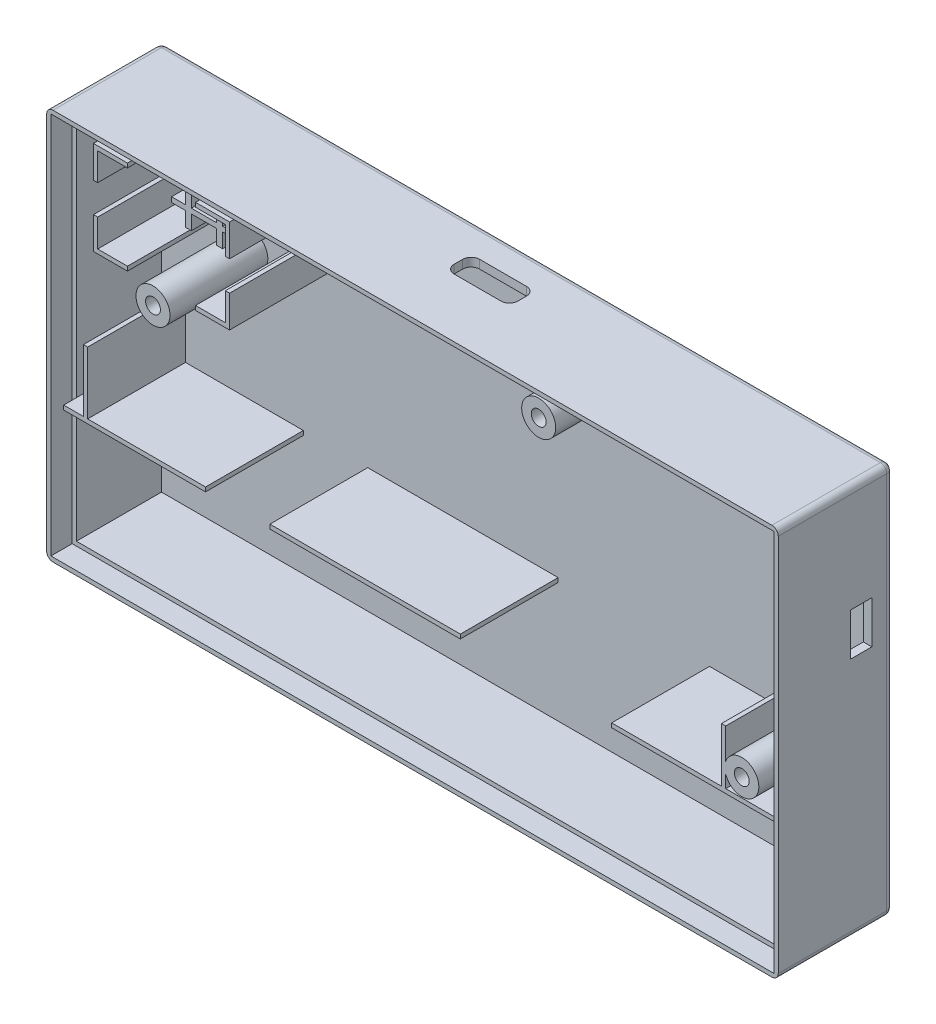
from build123d import *

# Parameters (mm, degrees)
SKETCH_1_W          = 172
SKETCH_1_H          = 92
EXTRUDE_1_DEPTH     = 2
SKETCH_2_W          = 172
SKETCH_2_H          = 92
SKETCH_2_W_2        = 168
SKETCH_2_H_2        = 88
EXTRUDE_2_DEPTH     = 25
EXTRUDE_3_DEPTH     = 25
SKETCH_4_W          = 5.927900585
SKETCH_4_H          = 3.296231716
EXTRUDE_4_DEPTH     = 15
SKETCH_5_R          = 4
EXTRUDE_5_DEPTH     = 23
SKETCH_6_R          = 1.75
CUT_EXTRUDE_1_DEPTH = 30
SKETCH_7_R          = 3
CUT_EXTRUDE_2_DEPTH = 22
SKETCH_8_R          = 4
EXTRUDE_6_DEPTH     = 23
SKETCH_9_R          = 1.75
CUT_EXTRUDE_3_DEPTH = 30
SKETCH_10_R         = 1.75
CUT_EXTRUDE_4_DEPTH = 30
SKETCH_11_R         = 3
CUT_EXTRUDE_5_DEPTH = 22
SKETCH_12_W         = 44.771170363
SKETCH_12_H         = 1
EXTRUDE_7_DEPTH     = 23
SKETCH_13_W         = 15
SKETCH_13_H         = 6
CUT_EXTRUDE_6_DEPTH = 23
FILLET_1_R          = 2
FILLET_2_R          = 3
SKETCH_14_W         = 5
SKETCH_14_H         = 10
CUT_EXTRUDE_7_DEPTH = 23
SKETCH_15_W         = 170
SKETCH_15_H         = 90
CUT_EXTRUDE_8_DEPTH = 5
FILLET_3_R          = 1.5


with BuildPart() as part:
    # 草图1 → 凸台-拉伸1 (new body)
    with BuildSketch(Plane.XY):
        with Locations((3.714694656, -11.181774809)):
            Rectangle(SKETCH_1_W, SKETCH_1_H)
    extrude(amount=EXTRUDE_1_DEPTH)

    # 草图2 → 凸台-拉伸2 (add)
    with BuildSketch(Plane.XY.offset(2)):
        with Locations((3.714694656, -11.181774809)):
            Rectangle(SKETCH_2_W, SKETCH_2_H)
        with Locations((3.714694656, -11.181774809)):
            Rectangle(SKETCH_2_W_2, SKETCH_2_H_2, mode=Mode.SUBTRACT)
    extrude(amount=EXTRUDE_2_DEPTH)

    # 草图3 → 凸台-拉伸3 (add)
    with BuildSketch(Plane.XY.offset(2)):
        Polygon((-71.285305344, 32.818225191), (-63.285305344, 32.818225191), (-63.285305344, 31.818225191), (-70.285305344, 31.818225191), (-70.285305344, 25.318225191), (-71.285305344, 25.318225191), align=None)
        Polygon((-71.285305344, 10.818225191), (-63.285305344, 10.818225191), (-63.285305344, 11.818225191), (-70.285305344, 11.818225191), (-70.285305344, 18.318225191), (-71.285305344, 18.318225191), align=None)
        Polygon((-39.285305344, 32.818225191), (-39.285305344, 25.318225191), (-40.285305344, 25.318225191), (-40.285305344, 31.818225191), (-47.285305344, 31.818225191), (-47.285305344, 32.818225191), align=None)
        Polygon((-40.285305344, 18.318225191), (-39.285305344, 18.318225191), (-39.285305344, 10.818225191), (-47.285305344, 10.818225191), (-47.285305344, 11.818225191), (-40.285305344, 11.818225191), align=None)
    extrude(amount=EXTRUDE_3_DEPTH)

    # 草图4 → 凸台-拉伸4 (add)
    with BuildSketch(Plane.XY.offset(2)):
        Polygon((-59.649980097, 24.438275263), (-59.649980097, 21.142043547), (-62.919629299, 21.142043547), (-62.919629299, 19.972412939), (-59.649980097, 19.972412939), (-59.649980097, 16.543268654), (-58.267689377, 16.543268654), (-58.267689377, 19.972412939), (-52.339788792, 19.972412939), (-52.339788792, 16.543268654), (-50.904333045, 16.543268654), (-50.904333045, 19.972412939), (-47.608101329, 19.972412939), (-47.608101329, 21.142043547), (-50.904333045, 21.142043547), (-50.904333045, 24.438275263), (-47.608101329, 24.438275263), (-47.608101329, 25.528158331), (-50.904333045, 25.528158331), (-50.904333045, 28.85097256), (-52.339788792, 28.85097256), (-52.339788792, 25.528158331), (-58.267689377, 25.528158331), (-58.267689377, 28.85097256), (-59.649980097, 28.85097256), (-59.649980097, 25.528158331), (-62.919629299, 25.528158331), (-62.919629299, 24.438275263), align=None)
        with Locations((-55.303739085, 22.790159405)):
            Rectangle(SKETCH_4_W, SKETCH_4_H, mode=Mode.SUBTRACT)
    extrude(amount=EXTRUDE_4_DEPTH)

    # 草图5 → 凸台-拉伸5 (add)
    with BuildSketch(Plane.XY.offset(2)):
        with Locations(Location((-59.285305344, 4.818225191, 0), (0, 0, 180))):
            Circle(SKETCH_5_R)
    extrude(amount=EXTRUDE_5_DEPTH)

    # 草图6 → 切除-拉伸1 (cut)
    with BuildSketch(Plane.XY.offset(25)):
        with Locations((-59.285305344, 4.818225191)):
            Circle(SKETCH_6_R)
    extrude(amount=-CUT_EXTRUDE_1_DEPTH, mode=Mode.SUBTRACT)

    # 草图7 → 切除-拉伸2 (cut)
    with BuildSketch(Plane(origin=(0, 0, 0), x_dir=(-1, 0, 0), z_dir=(0, 0, -1))):
        with Locations((59.285305344, 4.818225191)):
            Circle(SKETCH_7_R)
    extrude(amount=-CUT_EXTRUDE_2_DEPTH, mode=Mode.SUBTRACT)

    # 草图8 → 凸台-拉伸6 (add)
    with BuildSketch(Plane.XY.offset(2)):
        with Locations(Location((31.392694656, 27.297225191, 0), (0, 0, 180))):
            Circle(SKETCH_8_R)
        with Locations(Location((79.144694656, -21.978774809, 0), (0, 0, 180))):
            Circle(SKETCH_8_R)
    extrude(amount=EXTRUDE_6_DEPTH)

    # 草图9 → 切除-拉伸3 (cut)
    with BuildSketch(Plane.XY.offset(25)):
        with Locations((31.392694656, 27.297225191)):
            Circle(SKETCH_9_R)
    extrude(amount=-CUT_EXTRUDE_3_DEPTH, mode=Mode.SUBTRACT)

    # 草图10 → 切除-拉伸4 (cut)
    with BuildSketch(Plane.XY.offset(25)):
        with Locations((79.144694656, -21.978774809)):
            Circle(SKETCH_10_R)
    extrude(amount=-CUT_EXTRUDE_4_DEPTH, mode=Mode.SUBTRACT)

    # 草图11 → 切除-拉伸5 (cut)
    with BuildSketch(Plane(origin=(0, 0, 0), x_dir=(-1, 0, 0), z_dir=(0, 0, -1))):
        with Locations((-31.392694656, 27.297225191)):
            Circle(SKETCH_11_R)
        with Locations((-79.144694656, -21.978774809)):
            Circle(SKETCH_11_R)
    extrude(amount=-CUT_EXTRUDE_5_DEPTH, mode=Mode.SUBTRACT)

    # 草图12 → 凸台-拉伸7 (add)
    with BuildSketch(Plane.XY.offset(2)):
        Polygon((87.714694656, -26.239681565), (75.367291859, -26.239681565), (75.367291859, -13.468786918), (74.367291859, -13.468786918), (74.367291859, -26.239681565), (48.560091816, -26.239681565), (48.560091816, -27.239681565), (87.714694656, -27.239681565), align=None)
        Polygon((-80.285305344, -25.958692289), (-75.644143466, -25.958692289), (-75.644143466, -11.323392388), (-74.644143466, -11.323392388), (-74.644143466, -25.958692289), (-46.929156899, -25.958692289), (-46.929156899, -26.958692289), (-80.285305344, -26.958692289), align=None)
        with Locations((-9.415382556, -26.458692289)):
            Rectangle(SKETCH_12_W, SKETCH_12_H)
    extrude(amount=EXTRUDE_7_DEPTH)

    # 草图13 → 切除-拉伸6 (cut)
    with BuildSketch(Plane(origin=(0, 34.818225191, 0), x_dir=(1, 0, 0), z_dir=(0, 1, 0))):
        with Locations((5.214694656, -10.2)):
            Rectangle(SKETCH_13_W, SKETCH_13_H)
    extrude(amount=-CUT_EXTRUDE_6_DEPTH, mode=Mode.SUBTRACT)

    # 圆角1
    fillet_1_edges = [part.edges().sort_by_distance(p)[0] for p in [
        (-2.285305344, 33.818225191, 13.2),
        (-2.285305344, 33.818225191, 7.2),
        (12.714694656, 33.818225191, 7.2),
        (12.714694656, 33.818225191, 13.2),
    ]]
    fillet(fillet_1_edges, radius=FILLET_1_R)

    # 圆角2
    fillet_2_edges = [part.edges().sort_by_distance(p)[0] for p in [
        (-56.285305344, 4.818225191, 0),
        (34.392694656, 27.297225191, 0),
        (82.144694656, -21.978774809, 0),
    ]]
    fillet(fillet_2_edges, radius=FILLET_2_R)

    # 草图14 → 切除-拉伸7 (cut)
    with BuildSketch(Plane(origin=(89.714694656, 0, 0), x_dir=(0, 0, -1), z_dir=(1, 0, 0))):
        with Locations((-7.5, 4.818225191)):
            Rectangle(SKETCH_14_W, SKETCH_14_H)
    extrude(amount=-CUT_EXTRUDE_7_DEPTH, mode=Mode.SUBTRACT)

    # 草图15 → 切除-拉伸8 (cut)
    with BuildSketch(Plane.XY.offset(27)):
        with Locations((3.714694656, -11.181774809)):
            Rectangle(SKETCH_15_W, SKETCH_15_H)
        Polygon((-80.285305344, 32.818225191), (-71.285305344, 32.818225191), (-63.285305344, 32.818225191), (-47.285305344, 32.818225191), (-39.285305344, 32.818225191), (87.714694656, 32.818225191), (87.714694656, -55.181774809), (-80.285305344, -55.181774809), align=None, mode=Mode.SUBTRACT)
    extrude(amount=-CUT_EXTRUDE_8_DEPTH, mode=Mode.SUBTRACT)

    # 圆角3
    fillet_3_edges = [part.edges().sort_by_distance(p)[0] for p in [
        (-82.285305344, -11.181774809, 0),
        (3.714694656, 34.818225191, 0),
        (89.714694656, -11.181774809, 0),
        (3.714694656, -57.181774809, 0),
        (-82.285305344, -57.181774809, 13.5),
        (-82.285305344, 34.818225191, 13.5),
        (89.714694656, 34.818225191, 13.5),
        (89.714694656, -57.181774809, 13.5),
    ]]
    fillet(fillet_3_edges, radius=FILLET_3_R)


solid = part.part
